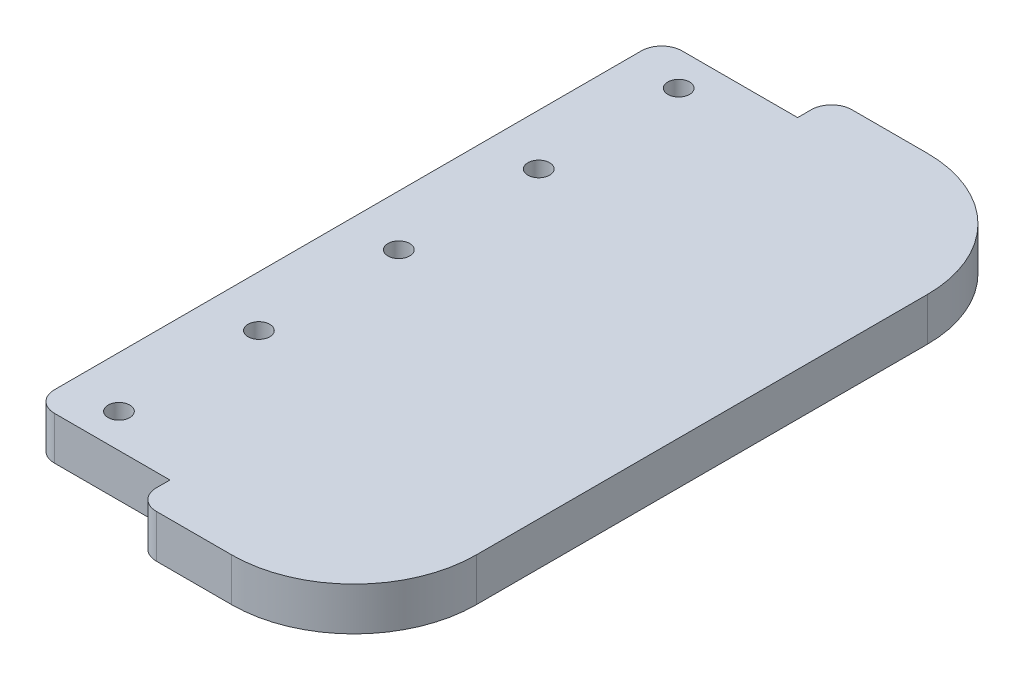
from build123d import *

# Parameters (mm, degrees)
SKETCH1_W           = 52.084
SKETCH1_H           = 102.362
BOSS_EXTRUDE1_DEPTH = 6.35
SKETCH1_4_R         = 1.6
CUT_EXTRUDE2_DEPTH  = 116.026277867
SKETCH1_5_R         = 11.684
SKETCH1_5_R_2       = 3.45
CUT_EXTRUDE3_DEPTH  = 4.7625
FILLET1_R           = 18
SKETCH1_7_W         = 20
SKETCH1_7_H         = 5
CUT_EXTRUDE4_DEPTH  = 116.026277867
FILLET4_R           = 3


with BuildPart() as part:
    # Sketch1 → Boss-Extrude1 (new body)
    with BuildSketch(Plane(origin=(0, 0, 0), x_dir=(1, 0, 0), z_dir=(0, 1, 0))):
        with Locations((26.042, 51.181)):
            Rectangle(SKETCH1_W, SKETCH1_H)
    extrude(amount=BOSS_EXTRUDE1_DEPTH)

    # Sketch1<4> → Cut-Extrude2 (cut, through all)
    with BuildSketch(Plane(origin=(0, 0, 0), x_dir=(1, 0, 0), z_dir=(0, 1, 0))):
        with BuildLine():
            ThreePointArc((9.1, 71.772), (8.63137085, 72.90337085), (7.5, 73.372))
            Line((7.5, 73.372), (7.5, 70.172))
            ThreePointArc((7.5, 70.172), (8.63137085, 70.64062915), (9.1, 71.772))
        make_face()
        with BuildLine():
            Line((7.5, 70.172), (7.5, 73.372))
            ThreePointArc((7.5, 73.372), (5.9, 71.772), (7.5, 70.172))
        make_face()
        with Locations(Location((7.5, 92.362, 0), (0, 0, 270))):
            Circle(SKETCH1_4_R)
        with Locations(Location((7.5, 51.182, 0), (0, 0, 270))):
            Circle(SKETCH1_4_R)
        with Locations(Location((7.5, 30.592, 0), (0, 0, 270))):
            Circle(SKETCH1_4_R)
        with Locations(Location((7.5, 10.002, 0), (0, 0, 270))):
            Circle(SKETCH1_4_R)
    extrude(amount=CUT_EXTRUDE2_DEPTH, mode=Mode.SUBTRACT)

    # Sketch1<5> → Cut-Extrude3 (cut)
    with BuildSketch(Plane(origin=(0, 0, 0), x_dir=(1, 0, 0), z_dir=(0, 1, 0))):
        with Locations(Location((38.876, 51.18, 0), (0, 0, 90))):
            Circle(SKETCH1_5_R)
        with Locations(Location((38.876, 95.63, 0), (0, 0, 90))):
            Circle(SKETCH1_5_R_2)
        with Locations(Location((38.876, 6.73, 0), (0, 0, 90))):
            Circle(SKETCH1_5_R_2)
    extrude(amount=CUT_EXTRUDE3_DEPTH, mode=Mode.SUBTRACT)

    # Fillet1
    fillet1_edges = [part.edges().sort_by_distance(p)[0] for p in [
        (52.084, 3.175, 0),
        (52.084, 3.175, -102.362),
    ]]
    fillet(fillet1_edges, radius=FILLET1_R)

    # Sketch1<7> → Cut-Extrude4 (cut, through all)
    with BuildSketch(Plane(origin=(0, 0, 0), x_dir=(1, 0, 0), z_dir=(0, 1, 0))):
        with Locations((10, 2.5)):
            Rectangle(SKETCH1_7_W, SKETCH1_7_H)
        with Locations((10, 99.862)):
            Rectangle(SKETCH1_7_W, SKETCH1_7_H)
    extrude(amount=CUT_EXTRUDE4_DEPTH, mode=Mode.SUBTRACT)

    # Fillet4
    fillet4_edges = [part.edges().sort_by_distance(p)[0] for p in [
        (0, 3.175, -5),
        (20, 3.175, 0),
        (0, 3.175, -97.362),
        (20, 3.175, -102.362),
    ]]
    fillet(fillet4_edges, radius=FILLET4_R)


solid = part.part
